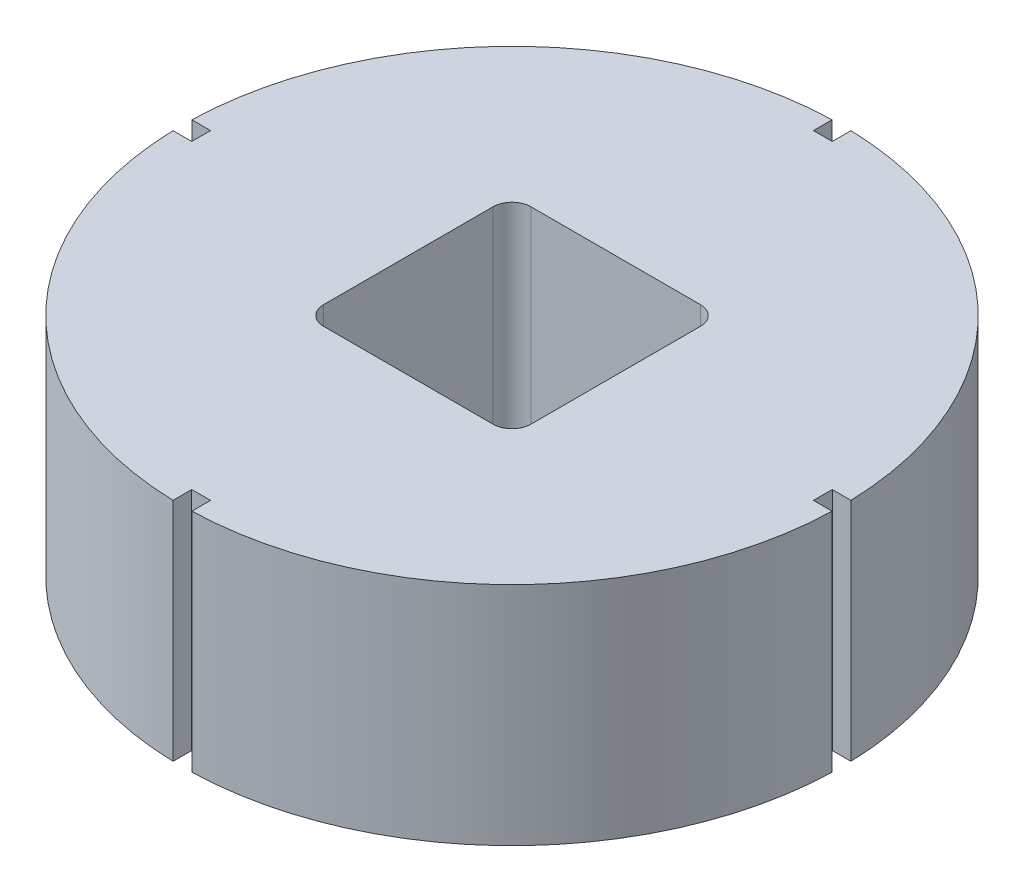
from build123d import *

# Parameters (mm, degrees)
SKETCH1_R           = 35
BOSS_EXTRUDE1_DEPTH = 24
SKETCH2_R           = 10
BOSS_EXTRUDE2_DEPTH = 5
CUT_EXTRUDE1_DEPTH  = 25
CUT_EXTRUDE2_DEPTH  = 36


with BuildPart() as part:
    # Sketch1 → Boss-Extrude1 (new body)
    with BuildSketch(Plane(origin=(0, 0, 0), x_dir=(1, 0, 0), z_dir=(0, 1, 0))):
        with Locations(Location((0, 0, 0), (0, 0, 270))):
            Circle(SKETCH1_R)
    extrude(amount=BOSS_EXTRUDE1_DEPTH)

    # Sketch2 → Boss-Extrude2 (add)
    with BuildSketch(Plane.XZ):
        with Locations(Location((0, 0, 0), (0, 0, 270))):
            Circle(SKETCH2_R)
    extrude(amount=BOSS_EXTRUDE2_DEPTH)

    # Sketch3 → Cut-Extrude1 (cut)
    with BuildSketch(Plane(origin=(0, 24, 0), x_dir=(1, 0, 0), z_dir=(0, 1, 0))):
        with BuildLine():
            Line((-9, 11), (9, 11))
            ThreePointArc((9, 11), (10.414213562, 10.414213562), (11, 9))
            Line((11, 9), (11, -9))
            ThreePointArc((11, -9), (10.414213562, -10.414213562), (9, -11))
            Line((9, -11), (-9, -11))
            ThreePointArc((-9, -11), (-10.414213562, -10.414213562), (-11, -9))
            Line((-11, -9), (-11, 9))
            ThreePointArc((-11, 9), (-10.414213562, 10.414213562), (-9, 11))
        make_face()
    extrude(amount=-CUT_EXTRUDE1_DEPTH, mode=Mode.SUBTRACT)


with BuildPart() as cut_extrude1_piece_1:
    # of the separate pieces the step leaves, piece 1, a body of its own (cut_extrude1_pieces)
    add(part.part.solids().sort_by_distance((0, 0, 35))[0])

    # Sketch4 → Cut-Extrude2 (cut)
    with BuildSketch(Plane(origin=(0, 24, 0), x_dir=(1, 0, 0), z_dir=(0, 1, 0))):
        with BuildLine():
            Line((-1, 34.985711369), (-1, 33))
            Line((-1, 33), (1, 33))
            Line((1, 33), (1, 34.985711369))
            ThreePointArc((1, 34.985711369), (0, 35), (-1, 34.985711369))
        make_face()
        with BuildLine():
            Line((34.985711369, 1), (33, 1))
            Line((33, 1), (33, -1))
            Line((33, -1), (34.985711369, -1))
            ThreePointArc((34.985711369, -1), (35, 0), (34.985711369, 1))
        make_face()
        with BuildLine():
            Line((1, -34.985711369), (1, -33))
            Line((1, -33), (-1, -33))
            Line((-1, -33), (-1, -34.985711369))
            ThreePointArc((-1, -34.985711369), (0, -35), (1, -34.985711369))
        make_face()
        with BuildLine():
            Line((-34.985711369, -1), (-33, -1))
            Line((-33, -1), (-33, 1))
            Line((-33, 1), (-34.985711369, 1))
            ThreePointArc((-34.985711369, 1), (-35, 0), (-34.985711369, -1))
        make_face()
    extrude(amount=-CUT_EXTRUDE2_DEPTH, mode=Mode.SUBTRACT)


with BuildPart() as cut_extrude1_piece_2:
    # of the separate pieces the step leaves, piece 2, a body of its own (cut_extrude1_pieces)
    add(part.part.solids().sort_by_distance((0, -1, -10))[0])


solid = Compound([cut_extrude1_piece_1.part, cut_extrude1_piece_2.part])
